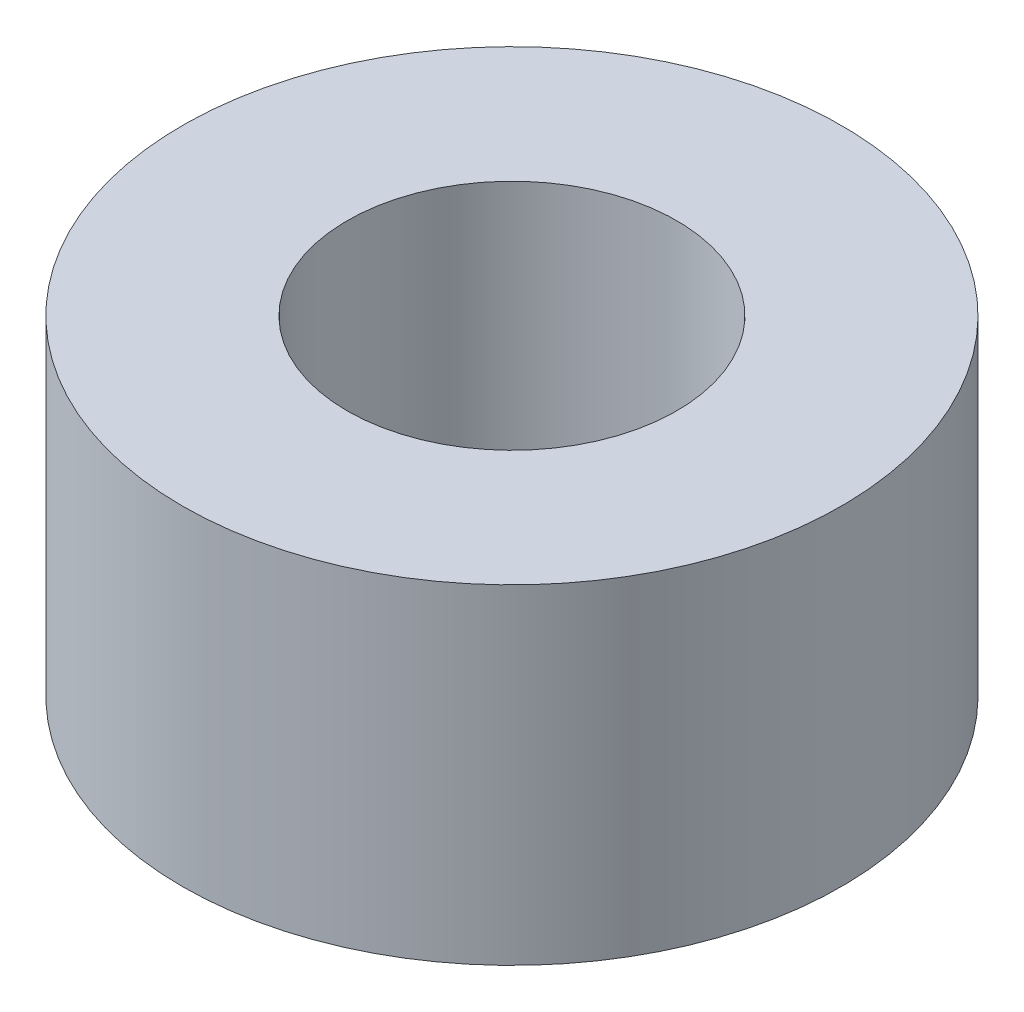
from build123d import *

# Parameters (mm, degrees)
SKETCH_1_R      = 4
SKETCH_1_R_2    = 2
EXTRUDE_1_DEPTH = 4


with BuildPart() as part:
    # 草图1 → 凸台-拉伸1 (new body)
    with BuildSketch(Plane(origin=(0, 0, 0), x_dir=(1, 0, 0), z_dir=(0, 1, 0))):
        with Locations(Location((0, 0, 0), (0, 0, 270))):
            Circle(SKETCH_1_R)
        with Locations(Location((0, 0, 0), (0, 0, 270))):
            Circle(SKETCH_1_R_2, mode=Mode.SUBTRACT)
    extrude(amount=EXTRUDE_1_DEPTH)


solid = part.part
